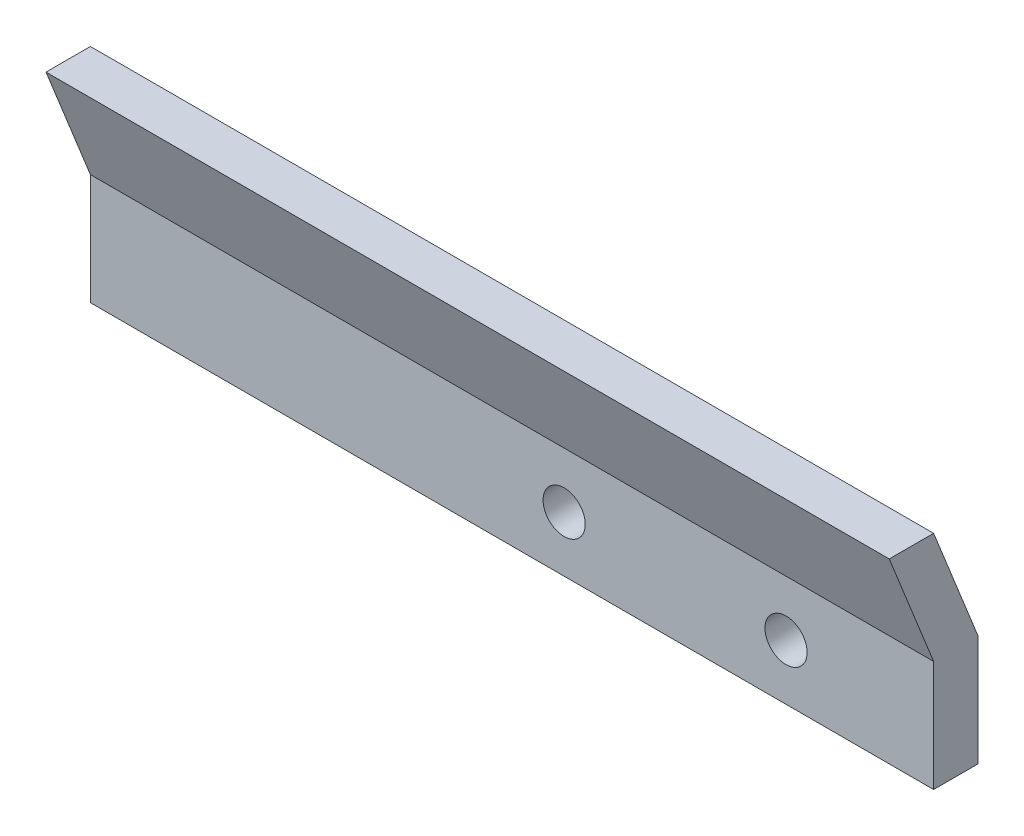
from build123d import *

# Parameters (mm, degrees)
SKETCH_1_W          = 38
SKETCH_1_H          = 5
SKETCH_1_R          = 0.95
EXTRUDE_1_DEPTH     = 2
EXTRUDE_2_DEPTH     = 38
SKETCH_3_R          = 0.95
CUT_EXTRUDE_1_DEPTH = 12


with BuildPart() as part:
    # 草图1 → 凸台-拉伸1 (new body)
    with BuildSketch(Plane.XY):
        with Locations((19, -2.5)):
            Rectangle(SKETCH_1_W, SKETCH_1_H)
        with Locations((31.35, -2.5)):
            Circle(SKETCH_1_R, mode=Mode.SUBTRACT)
    extrude(amount=EXTRUDE_1_DEPTH)

    # 草图2 → 凸台-拉伸2 (add)
    with BuildSketch(Plane(origin=(38, 0, 0), x_dir=(0, 0, -1), z_dir=(1, 0, 0))):
        Polygon((0, 0), (-2, 5), (-4, 5), (-2, 0), align=None)
    extrude(amount=-EXTRUDE_2_DEPTH)

    # 草图3 → 切除-拉伸1 (cut)
    with BuildSketch(Plane.XY.offset(2)):
        with Locations((21.35, -2.5)):
            Circle(SKETCH_3_R)
    extrude(amount=-CUT_EXTRUDE_1_DEPTH, mode=Mode.SUBTRACT)


solid = part.part
